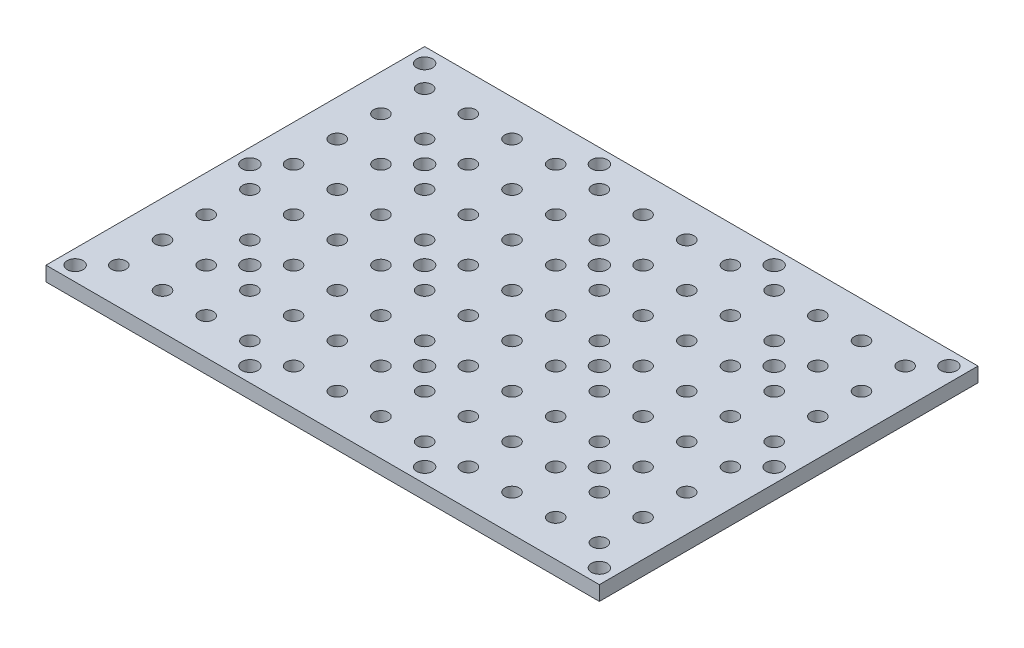
from build123d import *

# Parameters (mm, degrees)
SKETCH1_W                = 114
SKETCH1_H                = 78
BOSS_EXTRUDE1_DEPTH      = 1.5
SKETCH2_R                = 1.5
CUT_EXTRUDE2_DEPTH       = 70.081473638
LPATTERN1_COUNT          = 6
LPATTERN1_PITCH          = 9
LPATTERN1_COUNT_DIR2     = 4
LPATTERN1_PITCH_DIR2     = 9
MIRROR1_COPY_1_SKETCH_R  = 1.5
MIRROR1_COPY_1_DEPTH     = 70.081473638
MIRROR1_COPY_2_SKETCH_R  = 1.5
MIRROR1_COPY_2_DEPTH     = 70.081473638
MIRROR1_COPY_3_SKETCH_R  = 1.5
MIRROR1_COPY_3_DEPTH     = 70.081473638
MIRROR1_COPY_4_SKETCH_R  = 1.5
MIRROR1_COPY_4_DEPTH     = 70.081473638
MIRROR1_COPY_5_SKETCH_R  = 1.5
MIRROR1_COPY_5_DEPTH     = 70.081473638
MIRROR1_COPY_6_SKETCH_R  = 1.5
MIRROR1_COPY_6_DEPTH     = 70.081473638
MIRROR1_COPY_7_SKETCH_R  = 1.5
MIRROR1_COPY_7_DEPTH     = 70.081473638
MIRROR1_COPY_8_SKETCH_R  = 1.5
MIRROR1_COPY_8_DEPTH     = 70.081473638
MIRROR1_COPY_9_SKETCH_R  = 1.5
MIRROR1_COPY_9_DEPTH     = 70.081473638
MIRROR1_COPY_10_SKETCH_R = 1.5
MIRROR1_COPY_10_DEPTH    = 70.081473638
MIRROR1_COPY_11_SKETCH_R = 1.5
MIRROR1_COPY_11_DEPTH    = 70.081473638
MIRROR1_COPY_12_SKETCH_R = 1.5
MIRROR1_COPY_12_DEPTH    = 70.081473638
MIRROR1_COPY_13_SKETCH_R = 1.5
MIRROR1_COPY_13_DEPTH    = 70.081473638
MIRROR1_COPY_14_SKETCH_R = 1.5
MIRROR1_COPY_14_DEPTH    = 70.081473638
MIRROR1_COPY_15_SKETCH_R = 1.5
MIRROR1_COPY_15_DEPTH    = 70.081473638
MIRROR1_COPY_16_SKETCH_R = 1.5
MIRROR1_COPY_16_DEPTH    = 70.081473638
MIRROR1_COPY_17_SKETCH_R = 1.5
MIRROR1_COPY_17_DEPTH    = 70.081473638
MIRROR1_COPY_18_SKETCH_R = 1.5
MIRROR1_COPY_18_DEPTH    = 70.081473638
MIRROR1_COPY_19_SKETCH_R = 1.5
MIRROR1_COPY_19_DEPTH    = 70.081473638
MIRROR1_COPY_20_SKETCH_R = 1.5
MIRROR1_COPY_20_DEPTH    = 70.081473638
MIRROR1_COPY_21_SKETCH_R = 1.5
MIRROR1_COPY_21_DEPTH    = 70.081473638
MIRROR1_COPY_22_SKETCH_R = 1.5
MIRROR1_COPY_22_DEPTH    = 70.081473638
MIRROR1_COPY_23_SKETCH_R = 1.5
MIRROR1_COPY_23_DEPTH    = 70.081473638
MIRROR2_COPY_1_SKETCH_R  = 1.5
MIRROR2_COPY_1_DEPTH     = 70.081473638
MIRROR2_COPY_2_SKETCH_R  = 1.5
MIRROR2_COPY_2_DEPTH     = 70.081473638
MIRROR2_COPY_3_SKETCH_R  = 1.5
MIRROR2_COPY_3_DEPTH     = 70.081473638
MIRROR2_COPY_4_SKETCH_R  = 1.5
MIRROR2_COPY_4_DEPTH     = 70.081473638
MIRROR2_COPY_5_SKETCH_R  = 1.5
MIRROR2_COPY_5_DEPTH     = 70.081473638
MIRROR2_COPY_6_SKETCH_R  = 1.5
MIRROR2_COPY_6_DEPTH     = 70.081473638
MIRROR2_COPY_7_SKETCH_R  = 1.5
MIRROR2_COPY_7_DEPTH     = 70.081473638
MIRROR2_COPY_8_SKETCH_R  = 1.5
MIRROR2_COPY_8_DEPTH     = 70.081473638
MIRROR2_COPY_9_SKETCH_R  = 1.5
MIRROR2_COPY_9_DEPTH     = 70.081473638
MIRROR2_COPY_10_SKETCH_R = 1.5
MIRROR2_COPY_10_DEPTH    = 70.081473638
MIRROR2_COPY_11_SKETCH_R = 1.5
MIRROR2_COPY_11_DEPTH    = 70.081473638
MIRROR2_COPY_12_SKETCH_R = 1.5
MIRROR2_COPY_12_DEPTH    = 70.081473638
MIRROR2_COPY_13_SKETCH_R = 1.5
MIRROR2_COPY_13_DEPTH    = 70.081473638
MIRROR2_COPY_14_SKETCH_R = 1.5
MIRROR2_COPY_14_DEPTH    = 70.081473638
MIRROR2_COPY_15_SKETCH_R = 1.5
MIRROR2_COPY_15_DEPTH    = 70.081473638
MIRROR2_COPY_16_SKETCH_R = 1.5
MIRROR2_COPY_16_DEPTH    = 70.081473638
MIRROR2_COPY_17_SKETCH_R = 1.5
MIRROR2_COPY_17_DEPTH    = 70.081473638
MIRROR2_COPY_18_SKETCH_R = 1.5
MIRROR2_COPY_18_DEPTH    = 70.081473638
MIRROR2_COPY_19_SKETCH_R = 1.5
MIRROR2_COPY_19_DEPTH    = 70.081473638
MIRROR2_COPY_20_SKETCH_R = 1.5
MIRROR2_COPY_20_DEPTH    = 70.081473638
MIRROR2_COPY_21_SKETCH_R = 1.5
MIRROR2_COPY_21_DEPTH    = 70.081473638
MIRROR2_COPY_22_SKETCH_R = 1.5
MIRROR2_COPY_22_DEPTH    = 70.081473638
MIRROR2_COPY_23_SKETCH_R = 1.5
MIRROR2_COPY_23_DEPTH    = 70.081473638
MIRROR2_COPY_24_SKETCH_R = 1.5
MIRROR2_COPY_24_DEPTH    = 70.081473638
MIRROR2_COPY_25_SKETCH_R = 1.5
MIRROR2_COPY_25_DEPTH    = 70.081473638
MIRROR2_COPY_26_SKETCH_R = 1.5
MIRROR2_COPY_26_DEPTH    = 70.081473638
MIRROR2_COPY_27_SKETCH_R = 1.5
MIRROR2_COPY_27_DEPTH    = 70.081473638
MIRROR2_COPY_28_SKETCH_R = 1.5
MIRROR2_COPY_28_DEPTH    = 70.081473638
MIRROR2_COPY_29_SKETCH_R = 1.5
MIRROR2_COPY_29_DEPTH    = 70.081473638
MIRROR2_COPY_30_SKETCH_R = 1.5
MIRROR2_COPY_30_DEPTH    = 70.081473638
MIRROR2_COPY_31_SKETCH_R = 1.5
MIRROR2_COPY_31_DEPTH    = 70.081473638
MIRROR2_COPY_32_SKETCH_R = 1.5
MIRROR2_COPY_32_DEPTH    = 70.081473638
MIRROR2_COPY_33_SKETCH_R = 1.5
MIRROR2_COPY_33_DEPTH    = 70.081473638
MIRROR2_COPY_34_SKETCH_R = 1.5
MIRROR2_COPY_34_DEPTH    = 70.081473638
MIRROR2_COPY_35_SKETCH_R = 1.5
MIRROR2_COPY_35_DEPTH    = 70.081473638
MIRROR2_COPY_36_SKETCH_R = 1.5
MIRROR2_COPY_36_DEPTH    = 70.081473638
MIRROR2_COPY_37_SKETCH_R = 1.5
MIRROR2_COPY_37_DEPTH    = 70.081473638
MIRROR2_COPY_38_SKETCH_R = 1.5
MIRROR2_COPY_38_DEPTH    = 70.081473638
MIRROR2_COPY_39_SKETCH_R = 1.5
MIRROR2_COPY_39_DEPTH    = 70.081473638
MIRROR2_COPY_40_SKETCH_R = 1.5
MIRROR2_COPY_40_DEPTH    = 70.081473638
MIRROR2_COPY_41_SKETCH_R = 1.5
MIRROR2_COPY_41_DEPTH    = 70.081473638
MIRROR2_COPY_42_SKETCH_R = 1.5
MIRROR2_COPY_42_DEPTH    = 70.081473638
MIRROR2_COPY_43_SKETCH_R = 1.5
MIRROR2_COPY_43_DEPTH    = 70.081473638
MIRROR2_COPY_44_SKETCH_R = 1.5
MIRROR2_COPY_44_DEPTH    = 70.081473638
MIRROR2_COPY_45_SKETCH_R = 1.5
MIRROR2_COPY_45_DEPTH    = 70.081473638
MIRROR2_COPY_46_SKETCH_R = 1.5
MIRROR2_COPY_46_DEPTH    = 70.081473638
MIRROR2_COPY_47_SKETCH_R = 1.5
MIRROR2_COPY_47_DEPTH    = 70.081473638
F_4_CLEARANCE_HOLE1_D    = 3.2639


with BuildPart() as part:
    # Sketch1 → Boss-Extrude1 (new, symmetric)
    with BuildSketch(Plane(origin=(0, 0, 0), x_dir=(1, 0, 0), z_dir=(0, 1, 0))):
        Rectangle(SKETCH1_W, SKETCH1_H)
    extrude(amount=BOSS_EXTRUDE1_DEPTH, both=True)

    # Sketch2 → Cut-Extrude2 (cut, symmetric)
    with BuildSketch(Plane(origin=(0, 0, 0), x_dir=(1, 0, 0), z_dir=(0, 1, 0))):
        with Locations((-4.5, 4.5)):
            Circle(SKETCH2_R)
    cut_extrude2 = extrude(amount=CUT_EXTRUDE2_DEPTH, both=True, mode=Mode.SUBTRACT)

    # LPattern1: Cut-Extrude2 6 × 4
    with Locations(*[(-i * LPATTERN1_PITCH, 0, -j * LPATTERN1_PITCH_DIR2) for i in range(LPATTERN1_COUNT) for j in range(LPATTERN1_COUNT_DIR2) if (i, j) != (0, 0)]):
        add(cut_extrude2, mode=Mode.SUBTRACT)

    # Mirror1: Cut-Extrude2 across plane
    add(cut_extrude2.mirror(Plane.XY), mode=Mode.SUBTRACT)

    # Mirror1 copy 1 sketch → Mirror1 copy 1 (cut, symmetric)
    with BuildSketch(Plane(origin=(0, 0, 9), x_dir=(1, 0, 0), z_dir=(0, 1, 0))):
        with Locations((-4.5, -4.5)):
            Circle(MIRROR1_COPY_1_SKETCH_R)
    extrude(amount=MIRROR1_COPY_1_DEPTH, both=True, mode=Mode.SUBTRACT)

    # Mirror1 copy 2 sketch → Mirror1 copy 2 (cut, symmetric)
    with BuildSketch(Plane(origin=(0, 0, 18), x_dir=(1, 0, 0), z_dir=(0, 1, 0))):
        with Locations((-4.5, -4.5)):
            Circle(MIRROR1_COPY_2_SKETCH_R)
    extrude(amount=MIRROR1_COPY_2_DEPTH, both=True, mode=Mode.SUBTRACT)

    # Mirror1 copy 3 sketch → Mirror1 copy 3 (cut, symmetric)
    with BuildSketch(Plane(origin=(0, 0, 27), x_dir=(1, 0, 0), z_dir=(0, 1, 0))):
        with Locations((-4.5, -4.5)):
            Circle(MIRROR1_COPY_3_SKETCH_R)
    extrude(amount=MIRROR1_COPY_3_DEPTH, both=True, mode=Mode.SUBTRACT)

    # Mirror1 copy 4 sketch → Mirror1 copy 4 (cut, symmetric)
    with BuildSketch(Plane(origin=(-9, 0, 0), x_dir=(1, 0, 0), z_dir=(0, 1, 0))):
        with Locations((-4.5, -4.5)):
            Circle(MIRROR1_COPY_4_SKETCH_R)
    extrude(amount=MIRROR1_COPY_4_DEPTH, both=True, mode=Mode.SUBTRACT)

    # Mirror1 copy 5 sketch → Mirror1 copy 5 (cut, symmetric)
    with BuildSketch(Plane(origin=(-9, 0, 9), x_dir=(1, 0, 0), z_dir=(0, 1, 0))):
        with Locations((-4.5, -4.5)):
            Circle(MIRROR1_COPY_5_SKETCH_R)
    extrude(amount=MIRROR1_COPY_5_DEPTH, both=True, mode=Mode.SUBTRACT)

    # Mirror1 copy 6 sketch → Mirror1 copy 6 (cut, symmetric)
    with BuildSketch(Plane(origin=(-9, 0, 18), x_dir=(1, 0, 0), z_dir=(0, 1, 0))):
        with Locations((-4.5, -4.5)):
            Circle(MIRROR1_COPY_6_SKETCH_R)
    extrude(amount=MIRROR1_COPY_6_DEPTH, both=True, mode=Mode.SUBTRACT)

    # Mirror1 copy 7 sketch → Mirror1 copy 7 (cut, symmetric)
    with BuildSketch(Plane(origin=(-9, 0, 27), x_dir=(1, 0, 0), z_dir=(0, 1, 0))):
        with Locations((-4.5, -4.5)):
            Circle(MIRROR1_COPY_7_SKETCH_R)
    extrude(amount=MIRROR1_COPY_7_DEPTH, both=True, mode=Mode.SUBTRACT)

    # Mirror1 copy 8 sketch → Mirror1 copy 8 (cut, symmetric)
    with BuildSketch(Plane(origin=(-18, 0, 0), x_dir=(1, 0, 0), z_dir=(0, 1, 0))):
        with Locations((-4.5, -4.5)):
            Circle(MIRROR1_COPY_8_SKETCH_R)
    extrude(amount=MIRROR1_COPY_8_DEPTH, both=True, mode=Mode.SUBTRACT)

    # Mirror1 copy 9 sketch → Mirror1 copy 9 (cut, symmetric)
    with BuildSketch(Plane(origin=(-18, 0, 9), x_dir=(1, 0, 0), z_dir=(0, 1, 0))):
        with Locations((-4.5, -4.5)):
            Circle(MIRROR1_COPY_9_SKETCH_R)
    extrude(amount=MIRROR1_COPY_9_DEPTH, both=True, mode=Mode.SUBTRACT)

    # Mirror1 copy 10 sketch → Mirror1 copy 10 (cut, symmetric)
    with BuildSketch(Plane(origin=(-18, 0, 18), x_dir=(1, 0, 0), z_dir=(0, 1, 0))):
        with Locations((-4.5, -4.5)):
            Circle(MIRROR1_COPY_10_SKETCH_R)
    extrude(amount=MIRROR1_COPY_10_DEPTH, both=True, mode=Mode.SUBTRACT)

    # Mirror1 copy 11 sketch → Mirror1 copy 11 (cut, symmetric)
    with BuildSketch(Plane(origin=(-18, 0, 27), x_dir=(1, 0, 0), z_dir=(0, 1, 0))):
        with Locations((-4.5, -4.5)):
            Circle(MIRROR1_COPY_11_SKETCH_R)
    extrude(amount=MIRROR1_COPY_11_DEPTH, both=True, mode=Mode.SUBTRACT)

    # Mirror1 copy 12 sketch → Mirror1 copy 12 (cut, symmetric)
    with BuildSketch(Plane(origin=(-27, 0, 0), x_dir=(1, 0, 0), z_dir=(0, 1, 0))):
        with Locations((-4.5, -4.5)):
            Circle(MIRROR1_COPY_12_SKETCH_R)
    extrude(amount=MIRROR1_COPY_12_DEPTH, both=True, mode=Mode.SUBTRACT)

    # Mirror1 copy 13 sketch → Mirror1 copy 13 (cut, symmetric)
    with BuildSketch(Plane(origin=(-27, 0, 9), x_dir=(1, 0, 0), z_dir=(0, 1, 0))):
        with Locations((-4.5, -4.5)):
            Circle(MIRROR1_COPY_13_SKETCH_R)
    extrude(amount=MIRROR1_COPY_13_DEPTH, both=True, mode=Mode.SUBTRACT)

    # Mirror1 copy 14 sketch → Mirror1 copy 14 (cut, symmetric)
    with BuildSketch(Plane(origin=(-27, 0, 18), x_dir=(1, 0, 0), z_dir=(0, 1, 0))):
        with Locations((-4.5, -4.5)):
            Circle(MIRROR1_COPY_14_SKETCH_R)
    extrude(amount=MIRROR1_COPY_14_DEPTH, both=True, mode=Mode.SUBTRACT)

    # Mirror1 copy 15 sketch → Mirror1 copy 15 (cut, symmetric)
    with BuildSketch(Plane(origin=(-27, 0, 27), x_dir=(1, 0, 0), z_dir=(0, 1, 0))):
        with Locations((-4.5, -4.5)):
            Circle(MIRROR1_COPY_15_SKETCH_R)
    extrude(amount=MIRROR1_COPY_15_DEPTH, both=True, mode=Mode.SUBTRACT)

    # Mirror1 copy 16 sketch → Mirror1 copy 16 (cut, symmetric)
    with BuildSketch(Plane(origin=(-36, 0, 0), x_dir=(1, 0, 0), z_dir=(0, 1, 0))):
        with Locations((-4.5, -4.5)):
            Circle(MIRROR1_COPY_16_SKETCH_R)
    extrude(amount=MIRROR1_COPY_16_DEPTH, both=True, mode=Mode.SUBTRACT)

    # Mirror1 copy 17 sketch → Mirror1 copy 17 (cut, symmetric)
    with BuildSketch(Plane(origin=(-36, 0, 9), x_dir=(1, 0, 0), z_dir=(0, 1, 0))):
        with Locations((-4.5, -4.5)):
            Circle(MIRROR1_COPY_17_SKETCH_R)
    extrude(amount=MIRROR1_COPY_17_DEPTH, both=True, mode=Mode.SUBTRACT)

    # Mirror1 copy 18 sketch → Mirror1 copy 18 (cut, symmetric)
    with BuildSketch(Plane(origin=(-36, 0, 18), x_dir=(1, 0, 0), z_dir=(0, 1, 0))):
        with Locations((-4.5, -4.5)):
            Circle(MIRROR1_COPY_18_SKETCH_R)
    extrude(amount=MIRROR1_COPY_18_DEPTH, both=True, mode=Mode.SUBTRACT)

    # Mirror1 copy 19 sketch → Mirror1 copy 19 (cut, symmetric)
    with BuildSketch(Plane(origin=(-36, 0, 27), x_dir=(1, 0, 0), z_dir=(0, 1, 0))):
        with Locations((-4.5, -4.5)):
            Circle(MIRROR1_COPY_19_SKETCH_R)
    extrude(amount=MIRROR1_COPY_19_DEPTH, both=True, mode=Mode.SUBTRACT)

    # Mirror1 copy 20 sketch → Mirror1 copy 20 (cut, symmetric)
    with BuildSketch(Plane(origin=(-45, 0, 0), x_dir=(1, 0, 0), z_dir=(0, 1, 0))):
        with Locations((-4.5, -4.5)):
            Circle(MIRROR1_COPY_20_SKETCH_R)
    extrude(amount=MIRROR1_COPY_20_DEPTH, both=True, mode=Mode.SUBTRACT)

    # Mirror1 copy 21 sketch → Mirror1 copy 21 (cut, symmetric)
    with BuildSketch(Plane(origin=(-45, 0, 9), x_dir=(1, 0, 0), z_dir=(0, 1, 0))):
        with Locations((-4.5, -4.5)):
            Circle(MIRROR1_COPY_21_SKETCH_R)
    extrude(amount=MIRROR1_COPY_21_DEPTH, both=True, mode=Mode.SUBTRACT)

    # Mirror1 copy 22 sketch → Mirror1 copy 22 (cut, symmetric)
    with BuildSketch(Plane(origin=(-45, 0, 18), x_dir=(1, 0, 0), z_dir=(0, 1, 0))):
        with Locations((-4.5, -4.5)):
            Circle(MIRROR1_COPY_22_SKETCH_R)
    extrude(amount=MIRROR1_COPY_22_DEPTH, both=True, mode=Mode.SUBTRACT)

    # Mirror1 copy 23 sketch → Mirror1 copy 23 (cut, symmetric)
    with BuildSketch(Plane(origin=(-45, 0, 27), x_dir=(1, 0, 0), z_dir=(0, 1, 0))):
        with Locations((-4.5, -4.5)):
            Circle(MIRROR1_COPY_23_SKETCH_R)
    extrude(amount=MIRROR1_COPY_23_DEPTH, both=True, mode=Mode.SUBTRACT)

    # Mirror2: Cut-Extrude2 across plane
    add(cut_extrude2.mirror(Plane(origin=(0, 0, 0), x_dir=(0, 0, 1), z_dir=(1, 0, 0))), mode=Mode.SUBTRACT)

    # Mirror2 copy 1 sketch → Mirror2 copy 1 (cut, symmetric)
    with BuildSketch(Plane(origin=(0, 0, -9), x_dir=(-1, 0, 0), z_dir=(0, 1, 0))):
        with Locations((-4.5, -4.5)):
            Circle(MIRROR2_COPY_1_SKETCH_R)
    extrude(amount=MIRROR2_COPY_1_DEPTH, both=True, mode=Mode.SUBTRACT)

    # Mirror2 copy 2 sketch → Mirror2 copy 2 (cut, symmetric)
    with BuildSketch(Plane(origin=(0, 0, -18), x_dir=(-1, 0, 0), z_dir=(0, 1, 0))):
        with Locations((-4.5, -4.5)):
            Circle(MIRROR2_COPY_2_SKETCH_R)
    extrude(amount=MIRROR2_COPY_2_DEPTH, both=True, mode=Mode.SUBTRACT)

    # Mirror2 copy 3 sketch → Mirror2 copy 3 (cut, symmetric)
    with BuildSketch(Plane(origin=(0, 0, -27), x_dir=(-1, 0, 0), z_dir=(0, 1, 0))):
        with Locations((-4.5, -4.5)):
            Circle(MIRROR2_COPY_3_SKETCH_R)
    extrude(amount=MIRROR2_COPY_3_DEPTH, both=True, mode=Mode.SUBTRACT)

    # Mirror2 copy 4 sketch → Mirror2 copy 4 (cut, symmetric)
    with BuildSketch(Plane(origin=(9, 0, 0), x_dir=(-1, 0, 0), z_dir=(0, 1, 0))):
        with Locations((-4.5, -4.5)):
            Circle(MIRROR2_COPY_4_SKETCH_R)
    extrude(amount=MIRROR2_COPY_4_DEPTH, both=True, mode=Mode.SUBTRACT)

    # Mirror2 copy 5 sketch → Mirror2 copy 5 (cut, symmetric)
    with BuildSketch(Plane(origin=(9, 0, -9), x_dir=(-1, 0, 0), z_dir=(0, 1, 0))):
        with Locations((-4.5, -4.5)):
            Circle(MIRROR2_COPY_5_SKETCH_R)
    extrude(amount=MIRROR2_COPY_5_DEPTH, both=True, mode=Mode.SUBTRACT)

    # Mirror2 copy 6 sketch → Mirror2 copy 6 (cut, symmetric)
    with BuildSketch(Plane(origin=(9, 0, -18), x_dir=(-1, 0, 0), z_dir=(0, 1, 0))):
        with Locations((-4.5, -4.5)):
            Circle(MIRROR2_COPY_6_SKETCH_R)
    extrude(amount=MIRROR2_COPY_6_DEPTH, both=True, mode=Mode.SUBTRACT)

    # Mirror2 copy 7 sketch → Mirror2 copy 7 (cut, symmetric)
    with BuildSketch(Plane(origin=(9, 0, -27), x_dir=(-1, 0, 0), z_dir=(0, 1, 0))):
        with Locations((-4.5, -4.5)):
            Circle(MIRROR2_COPY_7_SKETCH_R)
    extrude(amount=MIRROR2_COPY_7_DEPTH, both=True, mode=Mode.SUBTRACT)

    # Mirror2 copy 8 sketch → Mirror2 copy 8 (cut, symmetric)
    with BuildSketch(Plane(origin=(18, 0, 0), x_dir=(-1, 0, 0), z_dir=(0, 1, 0))):
        with Locations((-4.5, -4.5)):
            Circle(MIRROR2_COPY_8_SKETCH_R)
    extrude(amount=MIRROR2_COPY_8_DEPTH, both=True, mode=Mode.SUBTRACT)

    # Mirror2 copy 9 sketch → Mirror2 copy 9 (cut, symmetric)
    with BuildSketch(Plane(origin=(18, 0, -9), x_dir=(-1, 0, 0), z_dir=(0, 1, 0))):
        with Locations((-4.5, -4.5)):
            Circle(MIRROR2_COPY_9_SKETCH_R)
    extrude(amount=MIRROR2_COPY_9_DEPTH, both=True, mode=Mode.SUBTRACT)

    # Mirror2 copy 10 sketch → Mirror2 copy 10 (cut, symmetric)
    with BuildSketch(Plane(origin=(18, 0, -18), x_dir=(-1, 0, 0), z_dir=(0, 1, 0))):
        with Locations((-4.5, -4.5)):
            Circle(MIRROR2_COPY_10_SKETCH_R)
    extrude(amount=MIRROR2_COPY_10_DEPTH, both=True, mode=Mode.SUBTRACT)

    # Mirror2 copy 11 sketch → Mirror2 copy 11 (cut, symmetric)
    with BuildSketch(Plane(origin=(18, 0, -27), x_dir=(-1, 0, 0), z_dir=(0, 1, 0))):
        with Locations((-4.5, -4.5)):
            Circle(MIRROR2_COPY_11_SKETCH_R)
    extrude(amount=MIRROR2_COPY_11_DEPTH, both=True, mode=Mode.SUBTRACT)

    # Mirror2 copy 12 sketch → Mirror2 copy 12 (cut, symmetric)
    with BuildSketch(Plane(origin=(27, 0, 0), x_dir=(-1, 0, 0), z_dir=(0, 1, 0))):
        with Locations((-4.5, -4.5)):
            Circle(MIRROR2_COPY_12_SKETCH_R)
    extrude(amount=MIRROR2_COPY_12_DEPTH, both=True, mode=Mode.SUBTRACT)

    # Mirror2 copy 13 sketch → Mirror2 copy 13 (cut, symmetric)
    with BuildSketch(Plane(origin=(27, 0, -9), x_dir=(-1, 0, 0), z_dir=(0, 1, 0))):
        with Locations((-4.5, -4.5)):
            Circle(MIRROR2_COPY_13_SKETCH_R)
    extrude(amount=MIRROR2_COPY_13_DEPTH, both=True, mode=Mode.SUBTRACT)

    # Mirror2 copy 14 sketch → Mirror2 copy 14 (cut, symmetric)
    with BuildSketch(Plane(origin=(27, 0, -18), x_dir=(-1, 0, 0), z_dir=(0, 1, 0))):
        with Locations((-4.5, -4.5)):
            Circle(MIRROR2_COPY_14_SKETCH_R)
    extrude(amount=MIRROR2_COPY_14_DEPTH, both=True, mode=Mode.SUBTRACT)

    # Mirror2 copy 15 sketch → Mirror2 copy 15 (cut, symmetric)
    with BuildSketch(Plane(origin=(27, 0, -27), x_dir=(-1, 0, 0), z_dir=(0, 1, 0))):
        with Locations((-4.5, -4.5)):
            Circle(MIRROR2_COPY_15_SKETCH_R)
    extrude(amount=MIRROR2_COPY_15_DEPTH, both=True, mode=Mode.SUBTRACT)

    # Mirror2 copy 16 sketch → Mirror2 copy 16 (cut, symmetric)
    with BuildSketch(Plane(origin=(36, 0, 0), x_dir=(-1, 0, 0), z_dir=(0, 1, 0))):
        with Locations((-4.5, -4.5)):
            Circle(MIRROR2_COPY_16_SKETCH_R)
    extrude(amount=MIRROR2_COPY_16_DEPTH, both=True, mode=Mode.SUBTRACT)

    # Mirror2 copy 17 sketch → Mirror2 copy 17 (cut, symmetric)
    with BuildSketch(Plane(origin=(36, 0, -9), x_dir=(-1, 0, 0), z_dir=(0, 1, 0))):
        with Locations((-4.5, -4.5)):
            Circle(MIRROR2_COPY_17_SKETCH_R)
    extrude(amount=MIRROR2_COPY_17_DEPTH, both=True, mode=Mode.SUBTRACT)

    # Mirror2 copy 18 sketch → Mirror2 copy 18 (cut, symmetric)
    with BuildSketch(Plane(origin=(36, 0, -18), x_dir=(-1, 0, 0), z_dir=(0, 1, 0))):
        with Locations((-4.5, -4.5)):
            Circle(MIRROR2_COPY_18_SKETCH_R)
    extrude(amount=MIRROR2_COPY_18_DEPTH, both=True, mode=Mode.SUBTRACT)

    # Mirror2 copy 19 sketch → Mirror2 copy 19 (cut, symmetric)
    with BuildSketch(Plane(origin=(36, 0, -27), x_dir=(-1, 0, 0), z_dir=(0, 1, 0))):
        with Locations((-4.5, -4.5)):
            Circle(MIRROR2_COPY_19_SKETCH_R)
    extrude(amount=MIRROR2_COPY_19_DEPTH, both=True, mode=Mode.SUBTRACT)

    # Mirror2 copy 20 sketch → Mirror2 copy 20 (cut, symmetric)
    with BuildSketch(Plane(origin=(45, 0, 0), x_dir=(-1, 0, 0), z_dir=(0, 1, 0))):
        with Locations((-4.5, -4.5)):
            Circle(MIRROR2_COPY_20_SKETCH_R)
    extrude(amount=MIRROR2_COPY_20_DEPTH, both=True, mode=Mode.SUBTRACT)

    # Mirror2 copy 21 sketch → Mirror2 copy 21 (cut, symmetric)
    with BuildSketch(Plane(origin=(45, 0, -9), x_dir=(-1, 0, 0), z_dir=(0, 1, 0))):
        with Locations((-4.5, -4.5)):
            Circle(MIRROR2_COPY_21_SKETCH_R)
    extrude(amount=MIRROR2_COPY_21_DEPTH, both=True, mode=Mode.SUBTRACT)

    # Mirror2 copy 22 sketch → Mirror2 copy 22 (cut, symmetric)
    with BuildSketch(Plane(origin=(45, 0, -18), x_dir=(-1, 0, 0), z_dir=(0, 1, 0))):
        with Locations((-4.5, -4.5)):
            Circle(MIRROR2_COPY_22_SKETCH_R)
    extrude(amount=MIRROR2_COPY_22_DEPTH, both=True, mode=Mode.SUBTRACT)

    # Mirror2 copy 23 sketch → Mirror2 copy 23 (cut, symmetric)
    with BuildSketch(Plane(origin=(45, 0, -27), x_dir=(-1, 0, 0), z_dir=(0, 1, 0))):
        with Locations((-4.5, -4.5)):
            Circle(MIRROR2_COPY_23_SKETCH_R)
    extrude(amount=MIRROR2_COPY_23_DEPTH, both=True, mode=Mode.SUBTRACT)

    # Mirror2 copy 24 sketch → Mirror2 copy 24 (cut, symmetric)
    with BuildSketch(Plane(origin=(0, 0, 0), x_dir=(-1, 0, 0), z_dir=(0, 1, 0))):
        with Locations((-4.5, 4.5)):
            Circle(MIRROR2_COPY_24_SKETCH_R)
    extrude(amount=MIRROR2_COPY_24_DEPTH, both=True, mode=Mode.SUBTRACT)

    # Mirror2 copy 25 sketch → Mirror2 copy 25 (cut, symmetric)
    with BuildSketch(Plane(origin=(0, 0, 9), x_dir=(-1, 0, 0), z_dir=(0, 1, 0))):
        with Locations((-4.5, 4.5)):
            Circle(MIRROR2_COPY_25_SKETCH_R)
    extrude(amount=MIRROR2_COPY_25_DEPTH, both=True, mode=Mode.SUBTRACT)

    # Mirror2 copy 26 sketch → Mirror2 copy 26 (cut, symmetric)
    with BuildSketch(Plane(origin=(0, 0, 18), x_dir=(-1, 0, 0), z_dir=(0, 1, 0))):
        with Locations((-4.5, 4.5)):
            Circle(MIRROR2_COPY_26_SKETCH_R)
    extrude(amount=MIRROR2_COPY_26_DEPTH, both=True, mode=Mode.SUBTRACT)

    # Mirror2 copy 27 sketch → Mirror2 copy 27 (cut, symmetric)
    with BuildSketch(Plane(origin=(0, 0, 27), x_dir=(-1, 0, 0), z_dir=(0, 1, 0))):
        with Locations((-4.5, 4.5)):
            Circle(MIRROR2_COPY_27_SKETCH_R)
    extrude(amount=MIRROR2_COPY_27_DEPTH, both=True, mode=Mode.SUBTRACT)

    # Mirror2 copy 28 sketch → Mirror2 copy 28 (cut, symmetric)
    with BuildSketch(Plane(origin=(9, 0, 0), x_dir=(-1, 0, 0), z_dir=(0, 1, 0))):
        with Locations((-4.5, 4.5)):
            Circle(MIRROR2_COPY_28_SKETCH_R)
    extrude(amount=MIRROR2_COPY_28_DEPTH, both=True, mode=Mode.SUBTRACT)

    # Mirror2 copy 29 sketch → Mirror2 copy 29 (cut, symmetric)
    with BuildSketch(Plane(origin=(9, 0, 9), x_dir=(-1, 0, 0), z_dir=(0, 1, 0))):
        with Locations((-4.5, 4.5)):
            Circle(MIRROR2_COPY_29_SKETCH_R)
    extrude(amount=MIRROR2_COPY_29_DEPTH, both=True, mode=Mode.SUBTRACT)

    # Mirror2 copy 30 sketch → Mirror2 copy 30 (cut, symmetric)
    with BuildSketch(Plane(origin=(9, 0, 18), x_dir=(-1, 0, 0), z_dir=(0, 1, 0))):
        with Locations((-4.5, 4.5)):
            Circle(MIRROR2_COPY_30_SKETCH_R)
    extrude(amount=MIRROR2_COPY_30_DEPTH, both=True, mode=Mode.SUBTRACT)

    # Mirror2 copy 31 sketch → Mirror2 copy 31 (cut, symmetric)
    with BuildSketch(Plane(origin=(9, 0, 27), x_dir=(-1, 0, 0), z_dir=(0, 1, 0))):
        with Locations((-4.5, 4.5)):
            Circle(MIRROR2_COPY_31_SKETCH_R)
    extrude(amount=MIRROR2_COPY_31_DEPTH, both=True, mode=Mode.SUBTRACT)

    # Mirror2 copy 32 sketch → Mirror2 copy 32 (cut, symmetric)
    with BuildSketch(Plane(origin=(18, 0, 0), x_dir=(-1, 0, 0), z_dir=(0, 1, 0))):
        with Locations((-4.5, 4.5)):
            Circle(MIRROR2_COPY_32_SKETCH_R)
    extrude(amount=MIRROR2_COPY_32_DEPTH, both=True, mode=Mode.SUBTRACT)

    # Mirror2 copy 33 sketch → Mirror2 copy 33 (cut, symmetric)
    with BuildSketch(Plane(origin=(18, 0, 9), x_dir=(-1, 0, 0), z_dir=(0, 1, 0))):
        with Locations((-4.5, 4.5)):
            Circle(MIRROR2_COPY_33_SKETCH_R)
    extrude(amount=MIRROR2_COPY_33_DEPTH, both=True, mode=Mode.SUBTRACT)

    # Mirror2 copy 34 sketch → Mirror2 copy 34 (cut, symmetric)
    with BuildSketch(Plane(origin=(18, 0, 18), x_dir=(-1, 0, 0), z_dir=(0, 1, 0))):
        with Locations((-4.5, 4.5)):
            Circle(MIRROR2_COPY_34_SKETCH_R)
    extrude(amount=MIRROR2_COPY_34_DEPTH, both=True, mode=Mode.SUBTRACT)

    # Mirror2 copy 35 sketch → Mirror2 copy 35 (cut, symmetric)
    with BuildSketch(Plane(origin=(18, 0, 27), x_dir=(-1, 0, 0), z_dir=(0, 1, 0))):
        with Locations((-4.5, 4.5)):
            Circle(MIRROR2_COPY_35_SKETCH_R)
    extrude(amount=MIRROR2_COPY_35_DEPTH, both=True, mode=Mode.SUBTRACT)

    # Mirror2 copy 36 sketch → Mirror2 copy 36 (cut, symmetric)
    with BuildSketch(Plane(origin=(27, 0, 0), x_dir=(-1, 0, 0), z_dir=(0, 1, 0))):
        with Locations((-4.5, 4.5)):
            Circle(MIRROR2_COPY_36_SKETCH_R)
    extrude(amount=MIRROR2_COPY_36_DEPTH, both=True, mode=Mode.SUBTRACT)

    # Mirror2 copy 37 sketch → Mirror2 copy 37 (cut, symmetric)
    with BuildSketch(Plane(origin=(27, 0, 9), x_dir=(-1, 0, 0), z_dir=(0, 1, 0))):
        with Locations((-4.5, 4.5)):
            Circle(MIRROR2_COPY_37_SKETCH_R)
    extrude(amount=MIRROR2_COPY_37_DEPTH, both=True, mode=Mode.SUBTRACT)

    # Mirror2 copy 38 sketch → Mirror2 copy 38 (cut, symmetric)
    with BuildSketch(Plane(origin=(27, 0, 18), x_dir=(-1, 0, 0), z_dir=(0, 1, 0))):
        with Locations((-4.5, 4.5)):
            Circle(MIRROR2_COPY_38_SKETCH_R)
    extrude(amount=MIRROR2_COPY_38_DEPTH, both=True, mode=Mode.SUBTRACT)

    # Mirror2 copy 39 sketch → Mirror2 copy 39 (cut, symmetric)
    with BuildSketch(Plane(origin=(27, 0, 27), x_dir=(-1, 0, 0), z_dir=(0, 1, 0))):
        with Locations((-4.5, 4.5)):
            Circle(MIRROR2_COPY_39_SKETCH_R)
    extrude(amount=MIRROR2_COPY_39_DEPTH, both=True, mode=Mode.SUBTRACT)

    # Mirror2 copy 40 sketch → Mirror2 copy 40 (cut, symmetric)
    with BuildSketch(Plane(origin=(36, 0, 0), x_dir=(-1, 0, 0), z_dir=(0, 1, 0))):
        with Locations((-4.5, 4.5)):
            Circle(MIRROR2_COPY_40_SKETCH_R)
    extrude(amount=MIRROR2_COPY_40_DEPTH, both=True, mode=Mode.SUBTRACT)

    # Mirror2 copy 41 sketch → Mirror2 copy 41 (cut, symmetric)
    with BuildSketch(Plane(origin=(36, 0, 9), x_dir=(-1, 0, 0), z_dir=(0, 1, 0))):
        with Locations((-4.5, 4.5)):
            Circle(MIRROR2_COPY_41_SKETCH_R)
    extrude(amount=MIRROR2_COPY_41_DEPTH, both=True, mode=Mode.SUBTRACT)

    # Mirror2 copy 42 sketch → Mirror2 copy 42 (cut, symmetric)
    with BuildSketch(Plane(origin=(36, 0, 18), x_dir=(-1, 0, 0), z_dir=(0, 1, 0))):
        with Locations((-4.5, 4.5)):
            Circle(MIRROR2_COPY_42_SKETCH_R)
    extrude(amount=MIRROR2_COPY_42_DEPTH, both=True, mode=Mode.SUBTRACT)

    # Mirror2 copy 43 sketch → Mirror2 copy 43 (cut, symmetric)
    with BuildSketch(Plane(origin=(36, 0, 27), x_dir=(-1, 0, 0), z_dir=(0, 1, 0))):
        with Locations((-4.5, 4.5)):
            Circle(MIRROR2_COPY_43_SKETCH_R)
    extrude(amount=MIRROR2_COPY_43_DEPTH, both=True, mode=Mode.SUBTRACT)

    # Mirror2 copy 44 sketch → Mirror2 copy 44 (cut, symmetric)
    with BuildSketch(Plane(origin=(45, 0, 0), x_dir=(-1, 0, 0), z_dir=(0, 1, 0))):
        with Locations((-4.5, 4.5)):
            Circle(MIRROR2_COPY_44_SKETCH_R)
    extrude(amount=MIRROR2_COPY_44_DEPTH, both=True, mode=Mode.SUBTRACT)

    # Mirror2 copy 45 sketch → Mirror2 copy 45 (cut, symmetric)
    with BuildSketch(Plane(origin=(45, 0, 9), x_dir=(-1, 0, 0), z_dir=(0, 1, 0))):
        with Locations((-4.5, 4.5)):
            Circle(MIRROR2_COPY_45_SKETCH_R)
    extrude(amount=MIRROR2_COPY_45_DEPTH, both=True, mode=Mode.SUBTRACT)

    # Mirror2 copy 46 sketch → Mirror2 copy 46 (cut, symmetric)
    with BuildSketch(Plane(origin=(45, 0, 18), x_dir=(-1, 0, 0), z_dir=(0, 1, 0))):
        with Locations((-4.5, 4.5)):
            Circle(MIRROR2_COPY_46_SKETCH_R)
    extrude(amount=MIRROR2_COPY_46_DEPTH, both=True, mode=Mode.SUBTRACT)

    # Mirror2 copy 47 sketch → Mirror2 copy 47 (cut, symmetric)
    with BuildSketch(Plane(origin=(45, 0, 27), x_dir=(-1, 0, 0), z_dir=(0, 1, 0))):
        with Locations((-4.5, 4.5)):
            Circle(MIRROR2_COPY_47_SKETCH_R)
    extrude(amount=MIRROR2_COPY_47_DEPTH, both=True, mode=Mode.SUBTRACT)

    # #4 Clearance Hole1 (through all)
    with Locations(Plane(origin=(0, 1.5, 0), x_dir=(1, 0, 0), z_dir=(0, 1, 0))):
        with Locations((-36, 18), (36, -18), (36, 18), (-36, -18), (0, 18), (0, -18), (-54, 36), (-18, 36), (18, 36), (54, 36), (54, 0), (18, 0), (-18, 0), (-54, 0), (-54, -36), (-18, -36), (18, -36), (54, -36)):
            Hole(F_4_CLEARANCE_HOLE1_D / 2)


solid = part.part
